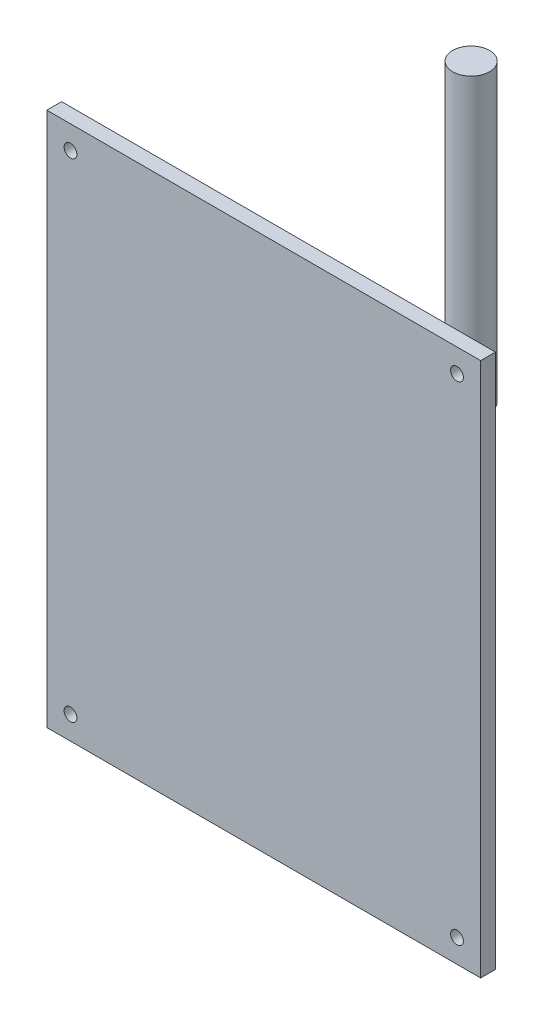
from build123d import *

# Parameters (mm, degrees)
SKETCH1_W                = 74.65
SKETCH1_H                = 92
BOSS_EXTRUDE1_DEPTH      = 2.54
BOSS_EXTRUDE2_DEPTH      = 38.1
BOSS_EXTRUDE2_DEPTH_BACK = 12.7
SKETCH2_R                = 3.175
SKETCH3_R                = 1.1
CUT_EXTRUDE1_DEPTH       = 2.54


with BuildPart() as part:
    # Sketch1 → Boss-Extrude1 (new body)
    with BuildSketch(Plane.XY):
        Rectangle(SKETCH1_W, SKETCH1_H)
    extrude(amount=BOSS_EXTRUDE1_DEPTH)

    # Sketch3 → Cut-Extrude1 (cut)
    with BuildSketch(Plane.XY.offset(2.54)):
        with Locations((-33.25, 42)):
            Circle(SKETCH3_R)
        with Locations((33.25, 42)):
            Circle(SKETCH3_R)
        with Locations((33.25, -42)):
            Circle(SKETCH3_R)
        with Locations((-33.25, -42)):
            Circle(SKETCH3_R)
    extrude(amount=-CUT_EXTRUDE1_DEPTH, mode=Mode.SUBTRACT)


with BuildPart() as body_2:
    # Sketch2 → Boss-Extrude2 (new, two sides: drawn at the far end of the back side and taken through both)
    with BuildSketch(Plane(origin=(0, 46, 0), x_dir=(1, 0, 0), z_dir=(0, 1, 0)).offset(-BOSS_EXTRUDE2_DEPTH_BACK)):
        with Locations(Location((29.963956952, 3.175, 0), (0, 0, 270))):
            Circle(SKETCH2_R)
    extrude(amount=BOSS_EXTRUDE2_DEPTH + BOSS_EXTRUDE2_DEPTH_BACK)


solid = Compound([part.part, body_2.part])
